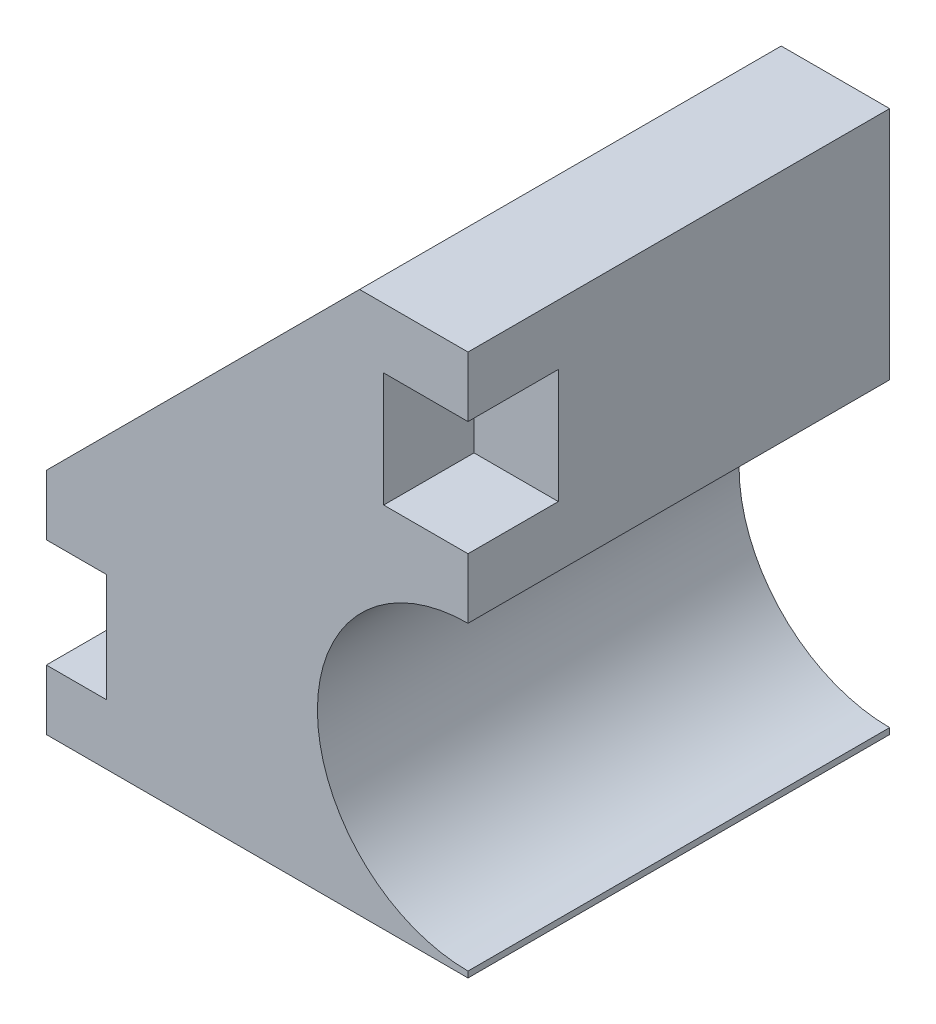
from build123d import *

# Parameters (mm, degrees)
BOSS_EXTRUDE1_DEPTH = 150
SKETCH3_W           = 35
SKETCH3_H           = 80
CUT_EXTRUDE1_DEPTH  = 150
SKETCH5_W           = 7.5
SKETCH5_H           = 9.5
CUT_EXTRUDE3_DEPTH  = 7
SKETCH6_W           = 7.5
SKETCH6_H           = 9
CUT_EXTRUDE4_DEPTH  = 5
SKETCH7_W           = 66.039270253
SKETCH7_H           = 79.533085961
CUT_EXTRUDE5_DEPTH  = 70


with BuildPart() as part:
    # Sketch2 → Boss-Extrude1 (new body)
    with BuildSketch(Plane.XY):
        with BuildLine():
            Line((0, 0), (-35, 0))
            Line((-35, 0), (-35, 19))
            Line((-35, 19), (-9, 45))
            Line((-9, 45), (0, 45))
            Line((0, 45), (0, 25.5))
            ThreePointArc((0, 25.5), (-12.5, 13), (0, 0.5))
            Line((0, 0.5), (0, 0))
        make_face()
    extrude(amount=BOSS_EXTRUDE1_DEPTH)

    # Sketch3 → Cut-Extrude1 (cut)
    with BuildSketch(Plane.XZ):
        with Locations((-17.5, 75)):
            Rectangle(SKETCH3_W, SKETCH3_H)
    extrude(amount=-CUT_EXTRUDE1_DEPTH, mode=Mode.SUBTRACT)


with BuildPart() as cut_extrude1_piece_1:
    # of the separate pieces the step leaves, piece 1, a body of its own (cut_extrude1_pieces)
    add(part.part.solids().sort_by_distance((0, 0.5, 115))[0])


with BuildPart() as cut_extrude1_piece_2:
    # of the separate pieces the step leaves, piece 2, a body of its own (cut_extrude1_pieces)
    add(part.part.solids().sort_by_distance((0, 25.5, 0))[0])


with BuildPart() as cut_extrude3_tool:
    # Sketch5 → Cut-Extrude3 (new body)
    with BuildSketch(Plane(origin=(0, 0, 0), x_dir=(0, 0, -1), z_dir=(1, 0, 0))):
        with Locations((-118.75, 35.25)):
            Rectangle(SKETCH5_W, SKETCH5_H)
        with Locations((-31.25, 35.25)):
            Rectangle(SKETCH5_W, SKETCH5_H)
    extrude(amount=-CUT_EXTRUDE3_DEPTH)


with BuildPart() as cut_extrude1_piece_1_1:
    add(cut_extrude1_piece_1.part)

    # Cut-Extrude3: cut by cut_extrude3_tool
    add(cut_extrude3_tool.part, mode=Mode.SUBTRACT)


with BuildPart() as cut_extrude1_piece_2_1:
    add(cut_extrude1_piece_2.part)

    # Cut-Extrude3: cut by cut_extrude3_tool
    add(cut_extrude3_tool.part, mode=Mode.SUBTRACT)


with BuildPart() as cut_extrude4_tool:
    # Sketch6 → Cut-Extrude4 (new body)
    with BuildSketch(Plane.ZY.offset(35)):
        with Locations((31.25, 9.5)):
            Rectangle(SKETCH6_W, SKETCH6_H)
        with Locations((118.75, 9.5)):
            Rectangle(SKETCH6_W, SKETCH6_H)
    extrude(amount=-CUT_EXTRUDE4_DEPTH)


with BuildPart() as cut_extrude1_piece_1_2:
    add(cut_extrude1_piece_1_1.part)

    # Cut-Extrude4: cut by cut_extrude4_tool
    add(cut_extrude4_tool.part, mode=Mode.SUBTRACT)

    # Sketch7 → Cut-Extrude5 (cut)
    with BuildSketch(Plane.ZY.offset(35)):
        with Locations((129.10930736, 20.534013606)):
            Rectangle(SKETCH7_W, SKETCH7_H)
    extrude(amount=-CUT_EXTRUDE5_DEPTH, mode=Mode.SUBTRACT)


with BuildPart() as cut_extrude1_piece_2_2:
    add(cut_extrude1_piece_2_1.part)

    # Cut-Extrude4: cut by cut_extrude4_tool
    add(cut_extrude4_tool.part, mode=Mode.SUBTRACT)


solid = cut_extrude1_piece_2_2.part
